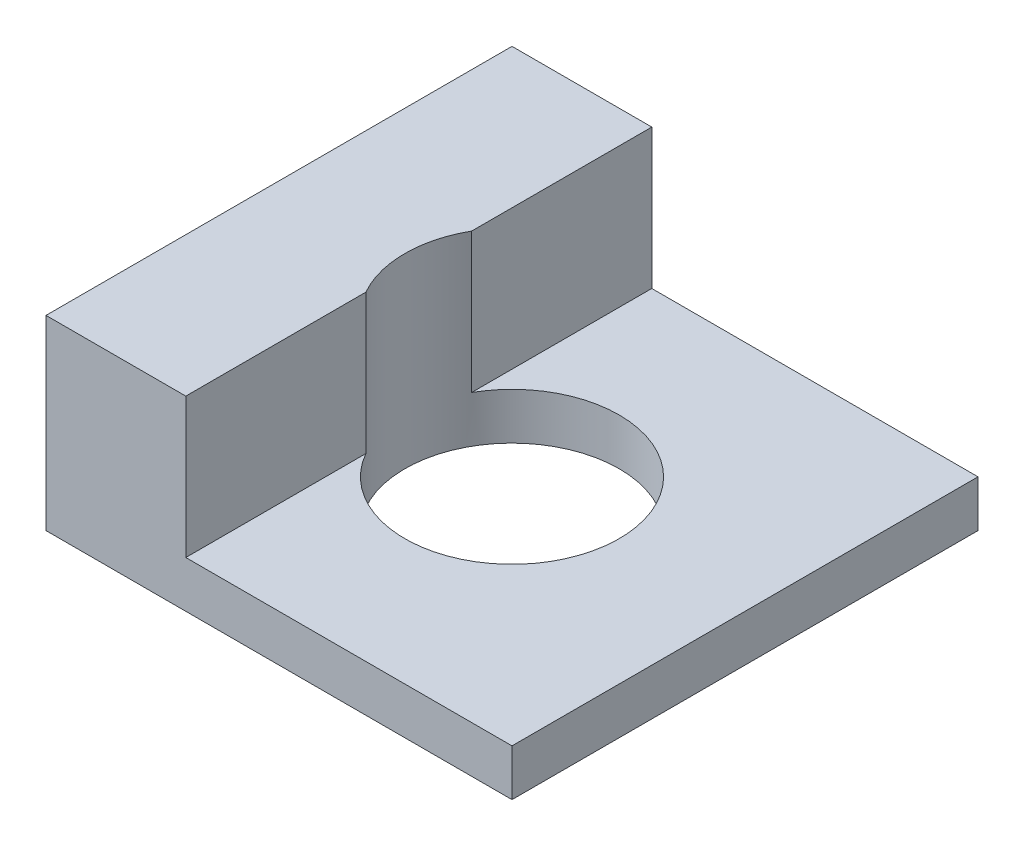
from build123d import *

# Parameters (mm, degrees)
SKETCH1_W           = 50
SKETCH1_H           = 50
BOSS_EXTRUDE1_DEPTH = 20
SKETCH2_R           = 11.5
CUT_EXTRUDE1_DEPTH  = 74.484692283
SKETCH3_W           = 38.473106937
SKETCH3_H           = 58.925618974
CUT_EXTRUDE2_DEPTH  = 15


with BuildPart() as part:
    # Sketch1 → Boss-Extrude1 (new body)
    with BuildSketch(Plane(origin=(0, 0, 0), x_dir=(1, 0, 0), z_dir=(0, 1, 0))):
        with Locations((25, 25)):
            Rectangle(SKETCH1_W, SKETCH1_H)
    extrude(amount=BOSS_EXTRUDE1_DEPTH)

    # Sketch2 → Cut-Extrude1 (cut, through all)
    with BuildSketch(Plane.XZ):
        with Locations(Location((25, -25, 0), (0, 0, 270))):
            Circle(SKETCH2_R)
    extrude(amount=-CUT_EXTRUDE1_DEPTH, mode=Mode.SUBTRACT)

    # Sketch3 → Cut-Extrude2 (cut)
    with BuildSketch(Plane(origin=(0, 20, 0), x_dir=(1, 0, 0), z_dir=(0, 1, 0))):
        with Locations((34.236553469, 26.583369284)):
            Rectangle(SKETCH3_W, SKETCH3_H)
    extrude(amount=-CUT_EXTRUDE2_DEPTH, mode=Mode.SUBTRACT)


solid = part.part
